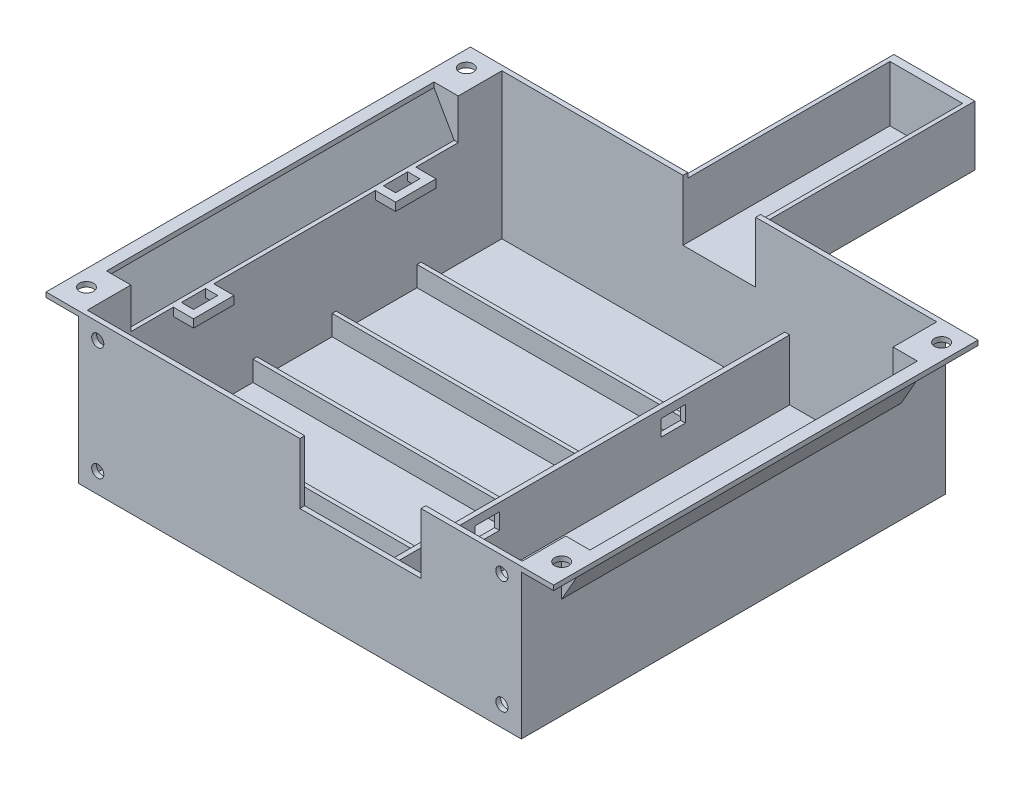
from build123d import *

# Parameters (mm, degrees)
EXTRUDE_1_DEPTH     = 105
SKETCH_3_W          = 107.6
SKETCH_3_H          = 1.2
EXTRUDE_3_DEPTH     = 36
SKETCH_4_R          = 3
SKETCH_4_W          = 70
SKETCH_4_H          = 1
EXTRUDE_4_DEPTH     = 5
CUT_EXTRUDE_1_REACH = 129.213
CUT_EXTRUDE_START   = -1
SKETCH_5_R          = 1.5
SKETCH_6_R          = 1.75
SKETCH_6_W          = 6
SKETCH_6_H          = 81
CUT_EXTRUDE_2_DEPTH = 10
EXTRUDE_8_DEPTH     = 82
EXTRUDE_9_DEPTH     = 1
EXTRUDE_10_DEPTH    = 1
CUT_EXTRUDE_3_REACH = 128.836
SKETCH_11_W         = 18
SKETCH_11_H         = 15
CUT_EXTRUDE_4_REACH = 129.82
SKETCH_12_R         = 1.5
SKETCH_12_W         = 30
SKETCH_12_H         = 15
EXTRUDE_11_DEPTH    = 50
SKETCH_14_W         = 20
SKETCH_14_H         = 14.8
EXTRUDE_12_DEPTH    = 2
SKETCH_15_W         = 6
SKETCH_15_H         = 10
SKETCH_15_W_2       = 3
SKETCH_15_H_2       = 6
EXTRUDE_13_DEPTH    = 2
CUT_EXTRUDE_5_REACH = 139.208
SKETCH_16_W         = 6
SKETCH_16_H         = 4


with BuildPart() as part:
    # 草图1 → 凸台-拉伸1 (new body)
    with BuildSketch(Plane.XY):
        Polygon((-54.8, 0), (54.8, 0), (54.8, 35.8), (62.8, 35.8), (62.8, 37), (53.8, 37), (53.8, 1), (17.4, 1), (17.4, 16), (16.2, 16), (16.2, 1), (-53.8, 1), (-53.8, 37), (-62.8, 37), (-62.8, 35.8), (-54.8, 35.8), align=None)
    extrude(amount=EXTRUDE_1_DEPTH)

    # 草图3 → 凸台-拉伸3 (add)
    with BuildSketch(Plane(origin=(0, 1, 0), x_dir=(1, 0, 0), z_dir=(0, 1, 0))):
        with Locations((0, -0.6)):
            Rectangle(SKETCH_3_W, SKETCH_3_H)
        with Locations((0, -104.4)):
            Rectangle(SKETCH_3_W, SKETCH_3_H)
    extrude(amount=EXTRUDE_3_DEPTH)

    # 草图4 → 凸台-拉伸4 (add)
    with BuildSketch(Plane(origin=(0, 1, 0), x_dir=(1, 0, 0), z_dir=(0, 1, 0))):
        with Locations((20, -89)):
            Circle(SKETCH_4_R)
        with Locations((-20, -89)):
            Circle(SKETCH_4_R)
        with Locations((-18.8, -21.7)):
            Rectangle(SKETCH_4_W, SKETCH_4_H)
        with Locations((-18.8, -42.7)):
            Rectangle(SKETCH_4_W, SKETCH_4_H)
        with Locations((-18.8, -62.3)):
            Rectangle(SKETCH_4_W, SKETCH_4_H)
        with Locations((-18.8, -83.3)):
            Rectangle(SKETCH_4_W, SKETCH_4_H)
    extrude(amount=EXTRUDE_4_DEPTH)

    # 草图5 → 切除-拉伸1 (cut, up to next)
    with BuildSketch(Plane(origin=(0, 6, 0), x_dir=(1, 0, 0), z_dir=(0, 1, 0)).offset(CUT_EXTRUDE_START), mode=Mode.PRIVATE) as cut_extrude_1_sk1:
        with Locations(Location((20, -89, 0), (0, 0, 180))):
            Circle(SKETCH_5_R)
    cut_extrude_1_tool1 = extrude(cut_extrude_1_sk1.sketch, amount=-CUT_EXTRUDE_1_REACH, mode=Mode.PRIVATE) & part.part
    # 草图5 → 切除-拉伸1 (cut, up to next)
    with BuildSketch(Plane(origin=(0, 6, 0), x_dir=(1, 0, 0), z_dir=(0, 1, 0)).offset(CUT_EXTRUDE_START), mode=Mode.PRIVATE) as cut_extrude_1_sk2:
        with Locations(Location((-20, -89, 0), (0, 0, 180))):
            Circle(SKETCH_5_R)
    cut_extrude_1_tool2 = extrude(cut_extrude_1_sk2.sketch, amount=-CUT_EXTRUDE_1_REACH, mode=Mode.PRIVATE) & part.part
    add(cut_extrude_1_tool1.solids().sort_by_distance((20, 5, 89))[0], mode=Mode.SUBTRACT)
    add(cut_extrude_1_tool2.solids().sort_by_distance((-20, 5, 89))[0], mode=Mode.SUBTRACT)

    # 草图6 → 切除-拉伸2 (cut)
    with BuildSketch(Plane(origin=(0, 37, 0), x_dir=(1, 0, 0), z_dir=(0, 1, 0))):
        with Locations(Location((58.8, -5, 0), (0, 0, 270))):
            Circle(SKETCH_6_R)
        with Locations(Location((58.8, -99, 0), (0, 0, 270))):
            Circle(SKETCH_6_R)
        with Locations(Location((-58.8, -99, 0), (0, 0, 180))):
            Circle(SKETCH_6_R)
        with Locations(Location((-58.8, -5, 0), (0, 0, 180))):
            Circle(SKETCH_6_R)
        with Locations((-56.8, -52.5)):
            Rectangle(SKETCH_6_W, SKETCH_6_H)
        with Locations((56.8, -52.5)):
            Rectangle(SKETCH_6_W, SKETCH_6_H)
    extrude(amount=-CUT_EXTRUDE_2_DEPTH, mode=Mode.SUBTRACT)

    # 草图7 → 凸台-拉伸8 (add)
    with BuildSketch(Plane.XY.offset(12)):
        Polygon((60.950143721, 35.8), (54.8, 24.975747051), (54.8, 27), (59.8, 35.8), align=None)
        Polygon((-54.8, 24.975747051), (-54.8, 27), (-59.8, 35.8), (-60.950143721, 35.8), align=None)
    extrude(amount=EXTRUDE_8_DEPTH)

    # 草图8 → 凸台-拉伸9 (add)
    with BuildSketch(Plane(origin=(0, 0, 12), x_dir=(-1, 0, 0), z_dir=(0, 0, -1))):
        Polygon((-54.8, 35.8), (-60.950143721, 35.8), (-54.8, 24.975747051), align=None)
        Polygon((54.8, 24.975747051), (54.8, 35.8), (60.950143721, 35.8), align=None)
    extrude(amount=EXTRUDE_9_DEPTH)

    # 草图10 → 凸台-拉伸10 (add)
    with BuildSketch(Plane.XY.offset(94)):
        Polygon((-60.950143721, 35.8), (-54.8, 35.8), (-54.8, 24.975747051), align=None)
        Polygon((54.8, 24.975747051), (60.950143721, 35.8), (54.8, 35.8), align=None)
    extrude(amount=EXTRUDE_10_DEPTH)

    # 草图11 → 切除-拉伸3 (cut, up to next)
    with BuildSketch(Plane.XY.offset(1.2), mode=Mode.PRIVATE) as cut_extrude_3_sk1:
        with Locations((0, 29.5)):
            Rectangle(SKETCH_11_W, SKETCH_11_H)
    cut_extrude_3_tool1 = extrude(cut_extrude_3_sk1.sketch, amount=-CUT_EXTRUDE_3_REACH, mode=Mode.PRIVATE) & part.part
    add(cut_extrude_3_tool1.solids().sort_by_distance((0, 29.5, 1.2))[0], mode=Mode.SUBTRACT)

    # 草图12 → 切除-拉伸4 (cut, up to next)
    with BuildSketch(Plane.XY.offset(105), mode=Mode.PRIVATE) as cut_extrude_4_sk1:
        with Locations((50, 5)):
            Circle(SKETCH_12_R)
    cut_extrude_4_tool1 = extrude(cut_extrude_4_sk1.sketch, amount=-CUT_EXTRUDE_4_REACH, mode=Mode.PRIVATE) & part.part
    # 草图12 → 切除-拉伸4 (cut, up to next)
    with BuildSketch(Plane.XY.offset(105), mode=Mode.PRIVATE) as cut_extrude_4_sk2:
        with Locations((50, 33)):
            Circle(SKETCH_12_R)
    cut_extrude_4_tool2 = extrude(cut_extrude_4_sk2.sketch, amount=-CUT_EXTRUDE_4_REACH, mode=Mode.PRIVATE) & part.part
    # 草图12 → 切除-拉伸4 (cut, up to next)
    with BuildSketch(Plane.XY.offset(105), mode=Mode.PRIVATE) as cut_extrude_4_sk3:
        with Locations((-50, 33)):
            Circle(SKETCH_12_R)
    cut_extrude_4_tool3 = extrude(cut_extrude_4_sk3.sketch, amount=-CUT_EXTRUDE_4_REACH, mode=Mode.PRIVATE) & part.part
    # 草图12 → 切除-拉伸4 (cut, up to next)
    with BuildSketch(Plane.XY.offset(105), mode=Mode.PRIVATE) as cut_extrude_4_sk4:
        with Locations((-50, 5)):
            Circle(SKETCH_12_R)
    cut_extrude_4_tool4 = extrude(cut_extrude_4_sk4.sketch, amount=-CUT_EXTRUDE_4_REACH, mode=Mode.PRIVATE) & part.part
    # 草图12 → 切除-拉伸4 (cut, up to next)
    with BuildSketch(Plane.XY.offset(105), mode=Mode.PRIVATE) as cut_extrude_4_sk5:
        with Locations((15, 29.5)):
            Rectangle(SKETCH_12_W, SKETCH_12_H)
    cut_extrude_4_tool5 = extrude(cut_extrude_4_sk5.sketch, amount=-CUT_EXTRUDE_4_REACH, mode=Mode.PRIVATE) & part.part
    add(cut_extrude_4_tool1.solids().sort_by_distance((50, 5, 105))[0], mode=Mode.SUBTRACT)
    add(cut_extrude_4_tool2.solids().sort_by_distance((50, 33, 105))[0], mode=Mode.SUBTRACT)
    add(cut_extrude_4_tool3.solids().sort_by_distance((-50, 33, 105))[0], mode=Mode.SUBTRACT)
    add(cut_extrude_4_tool4.solids().sort_by_distance((-50, 5, 105))[0], mode=Mode.SUBTRACT)
    add(cut_extrude_4_tool5.solids().sort_by_distance((15, 29.5, 105))[0], mode=Mode.SUBTRACT)

    # 草图13 → 凸台-拉伸11 (add)
    with BuildSketch(Plane(origin=(0, 0, 0), x_dir=(-1, 0, 0), z_dir=(0, 0, -1))):
        Polygon((9, 35.8), (9, 22), (-9, 22), (-9, 35.8), (-10, 35.8), (-10, 21), (10, 21), (10, 35.8), align=None)
    extrude(amount=EXTRUDE_11_DEPTH)

    # 草图14 → 凸台-拉伸12 (add)
    with BuildSketch(Plane(origin=(0, 0, -50), x_dir=(-1, 0, 0), z_dir=(0, 0, -1))):
        with Locations((0, 28.4)):
            Rectangle(SKETCH_14_W, SKETCH_14_H)
    extrude(amount=EXTRUDE_12_DEPTH)

    # 草图15 → 凸台-拉伸13 (add)
    # profile 1 of 2: a face of its own
    with BuildSketch(Plane(origin=(0, 27, 0), x_dir=(1, 0, 0), z_dir=(0, 1, 0))):
        with Locations((-51.8, -27.5)):
            Rectangle(SKETCH_15_W, SKETCH_15_H)
        with Locations((-52.3, -27.5)):
            Rectangle(SKETCH_15_W_2, SKETCH_15_H_2, mode=Mode.SUBTRACT)
    # profile 2 of 2: a face of its own
    with BuildSketch(Plane(origin=(0, 27, 0), x_dir=(1, 0, 0), z_dir=(0, 1, 0))):
        with Locations((-51.8, -77.5)):
            Rectangle(SKETCH_15_W, SKETCH_15_H)
        with Locations((-52.3, -77.5)):
            Rectangle(SKETCH_15_W_2, SKETCH_15_H_2, mode=Mode.SUBTRACT)
    extrude(amount=-EXTRUDE_13_DEPTH)

    # 草图16 → 切除-拉伸5 (cut, up to next)
    with BuildSketch(Plane(origin=(17.4, 0, 0), x_dir=(0, 0, -1), z_dir=(1, 0, 0)), mode=Mode.PRIVATE) as cut_extrude_5_sk1:
        with Locations((-76, 12)):
            Rectangle(SKETCH_16_W, SKETCH_16_H)
    cut_extrude_5_tool1 = extrude(cut_extrude_5_sk1.sketch, amount=-CUT_EXTRUDE_5_REACH, mode=Mode.PRIVATE) & part.part
    # 草图16 → 切除-拉伸5 (cut, up to next)
    with BuildSketch(Plane(origin=(17.4, 0, 0), x_dir=(0, 0, -1), z_dir=(1, 0, 0)), mode=Mode.PRIVATE) as cut_extrude_5_sk2:
        with Locations((-30, 12)):
            Rectangle(SKETCH_16_W, SKETCH_16_H)
    cut_extrude_5_tool2 = extrude(cut_extrude_5_sk2.sketch, amount=-CUT_EXTRUDE_5_REACH, mode=Mode.PRIVATE) & part.part
    add(cut_extrude_5_tool1.solids().sort_by_distance((17.4, 12, 76))[0], mode=Mode.SUBTRACT)
    add(cut_extrude_5_tool2.solids().sort_by_distance((17.4, 12, 30))[0], mode=Mode.SUBTRACT)


solid = part.part
